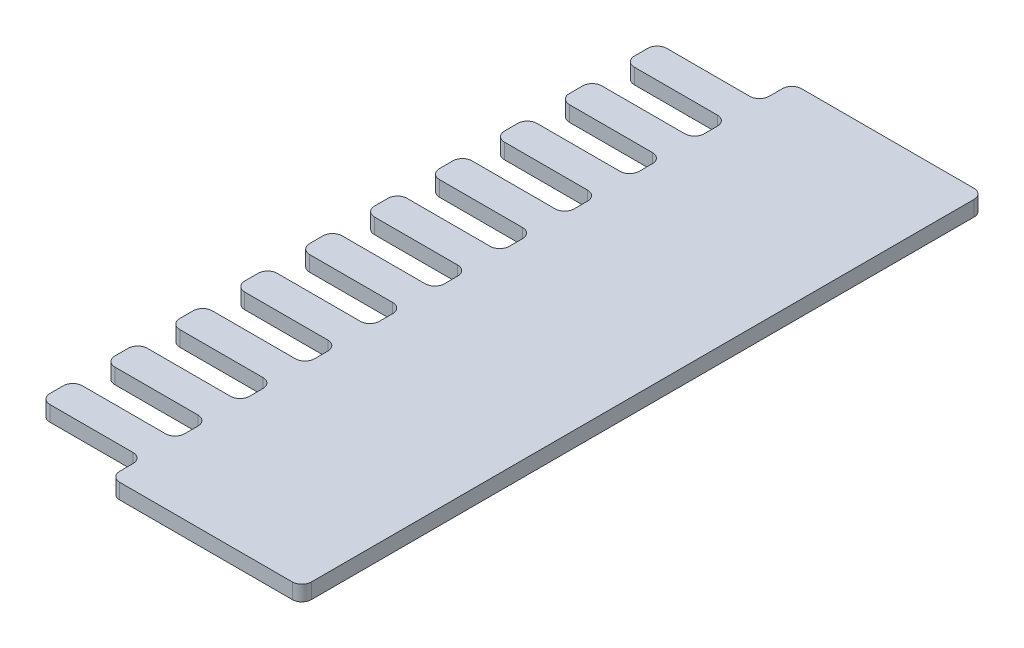
from build123d import *

# Parameters (mm, degrees)
BOSS_EXTRUDE1_DEPTH = 1.2


with BuildPart() as part:
    # Sketch1 → Boss-Extrude1 (new body)
    with BuildSketch(Plane(origin=(0, 0, 0), x_dir=(1, 0, 0), z_dir=(0, 1, 0))):
        with BuildLine():
            Line((-0.75, 2.54), (-7.25, 2.54))
            ThreePointArc((-7.25, 2.54), (-7.780330086, 2.759669914), (-8, 3.29))
            Line((-8, 3.29), (-8, 4.33))
            ThreePointArc((-8, 4.33), (-7.780330086, 4.860330086), (-7.25, 5.08))
            Line((-7.25, 5.08), (-0.75, 5.08))
            ThreePointArc((-0.75, 5.08), (-0.219669914, 5.299669914), (0, 5.83))
            Line((0, 5.83), (0, 6.87))
            ThreePointArc((0, 6.87), (-0.219669914, 7.400330086), (-0.75, 7.62))
            Line((-0.75, 7.62), (-7.25, 7.62))
            ThreePointArc((-7.25, 7.62), (-7.780330086, 7.839669914), (-8, 8.37))
            Line((-8, 8.37), (-8, 9.41))
            ThreePointArc((-8, 9.41), (-7.780330086, 9.940330086), (-7.25, 10.16))
            Line((-7.25, 10.16), (-0.75, 10.16))
            ThreePointArc((-0.75, 10.16), (-0.219669914, 10.379669914), (0, 10.91))
            Line((0, 10.91), (0, 11.95))
            ThreePointArc((0, 11.95), (-0.219669914, 12.480330086), (-0.75, 12.7))
            Line((-0.75, 12.7), (-7.25, 12.7))
            ThreePointArc((-7.25, 12.7), (-7.780330086, 12.919669914), (-8, 13.45))
            Line((-8, 13.45), (-8, 14.49))
            ThreePointArc((-8, 14.49), (-7.780330086, 15.020330086), (-7.25, 15.24))
            Line((-7.25, 15.24), (-0.75, 15.24))
            ThreePointArc((-0.75, 15.24), (-0.219669914, 15.459669914), (0, 15.99))
            Line((0, 15.99), (0, 17.03))
            ThreePointArc((0, 17.03), (-0.219669914, 17.560330086), (-0.75, 17.78))
            Line((-0.75, 17.78), (-7.25, 17.78))
            ThreePointArc((-7.25, 17.78), (-7.780330086, 17.999669914), (-8, 18.53))
            Line((-8, 18.53), (-8, 19.57))
            ThreePointArc((-8, 19.57), (-7.780330086, 20.100330086), (-7.25, 20.32))
            Line((-7.25, 20.32), (-0.75, 20.32))
            ThreePointArc((-0.75, 20.32), (-0.219669914, 20.539669914), (0, 21.07))
            Line((0, 21.07), (0, 22.11))
            ThreePointArc((0, 22.11), (-0.219669914, 22.640330086), (-0.75, 22.86))
            Line((-0.75, 22.86), (-7.25, 22.86))
            ThreePointArc((-7.25, 22.86), (-7.780330086, 23.079669914), (-8, 23.61))
            Line((-8, 23.61), (-8, 24.65))
            ThreePointArc((-8, 24.65), (-7.780330086, 25.180330086), (-7.25, 25.4))
            Line((-7.25, 25.4), (-0.75, 25.4))
            ThreePointArc((-0.75, 25.4), (-0.219669914, 25.619669914), (0, 26.15))
            Line((0, 26.15), (0, 27.19))
            ThreePointArc((0, 27.19), (-0.219669914, 27.720330086), (-0.75, 27.94))
            Line((-0.75, 27.94), (-7.25, 27.94))
            ThreePointArc((-7.25, 27.94), (-7.780330086, 28.159669914), (-8, 28.69))
            Line((-8, 28.69), (-8, 29.73))
            ThreePointArc((-8, 29.73), (-7.780330086, 30.260330086), (-7.25, 30.48))
            Line((-7.25, 30.48), (-0.75, 30.48))
            ThreePointArc((-0.75, 30.48), (-0.219669914, 30.699669914), (0, 31.23))
            Line((0, 31.23), (0, 32.27))
            ThreePointArc((0, 32.27), (-0.219669914, 32.800330086), (-0.75, 33.02))
            Line((-0.75, 33.02), (-7.25, 33.02))
            ThreePointArc((-7.25, 33.02), (-7.780330086, 33.239669914), (-8, 33.77))
            Line((-8, 33.77), (-8, 34.81))
            ThreePointArc((-8, 34.81), (-7.780330086, 35.340330086), (-7.25, 35.56))
            Line((-7.25, 35.56), (-0.75, 35.56))
            ThreePointArc((-0.75, 35.56), (-0.219669914, 35.779669914), (0, 36.31))
            Line((0, 36.31), (0, 37.35))
            ThreePointArc((0, 37.35), (-0.219669914, 37.880330086), (-0.75, 38.1))
            Line((-0.75, 38.1), (-7.25, 38.1))
            ThreePointArc((-7.25, 38.1), (-7.780330086, 38.319669914), (-8, 38.85))
            Line((-8, 38.85), (-8, 39.89))
            ThreePointArc((-8, 39.89), (-7.780330086, 40.420330086), (-7.25, 40.64))
            Line((-7.25, 40.64), (-0.75, 40.64))
            ThreePointArc((-0.75, 40.64), (-0.219669914, 40.859669914), (0, 41.39))
            Line((0, 41.39), (0, 42.43))
            ThreePointArc((0, 42.43), (-0.219669914, 42.960330086), (-0.75, 43.18))
            Line((-0.75, 43.18), (-7.25, 43.18))
            ThreePointArc((-7.25, 43.18), (-7.780330086, 43.399669914), (-8, 43.93))
            Line((-8, 43.93), (-8, 44.97))
            ThreePointArc((-8, 44.97), (-7.780330086, 45.500330086), (-7.25, 45.72))
            Line((-7.25, 45.72), (-0.75, 45.72))
            ThreePointArc((-0.75, 45.72), (-0.219669914, 45.939669914), (0, 46.47))
            Line((0, 46.47), (0, 47.51))
            ThreePointArc((0, 47.51), (-0.219669914, 48.040330086), (-0.75, 48.26))
            Line((-0.75, 48.26), (-7.25, 48.26))
            ThreePointArc((-7.25, 48.26), (-7.780330086, 48.479669914), (-8, 49.01))
            Line((-8, 49.01), (-8, 50.05))
            ThreePointArc((-8, 50.05), (-7.780330086, 50.580330086), (-7.25, 50.8))
            Line((-7.25, 50.8), (-0.75, 50.8))
            ThreePointArc((-0.75, 50.8), (-0.219669914, 51.019669914), (0, 51.55))
            Line((0, 51.55), (0, 52.59))
            ThreePointArc((0, 52.59), (0.219669914, 53.120330086), (0.75, 53.34))
            Line((0.75, 53.34), (14.25, 53.34))
            ThreePointArc((14.25, 53.34), (14.780330086, 53.120330086), (15, 52.59))
            Line((15, 52.59), (15, 0.75))
            ThreePointArc((15, 0.75), (14.780330086, 0.219669914), (14.25, 0))
            Line((14.25, 0), (0.75, 0))
            ThreePointArc((0.75, 0), (0.219669914, 0.219669914), (0, 0.75))
            Line((0, 0.75), (0, 1.79))
            ThreePointArc((0, 1.79), (-0.219669914, 2.320330086), (-0.75, 2.54))
        make_face()
    extrude(amount=BOSS_EXTRUDE1_DEPTH)


solid = part.part
